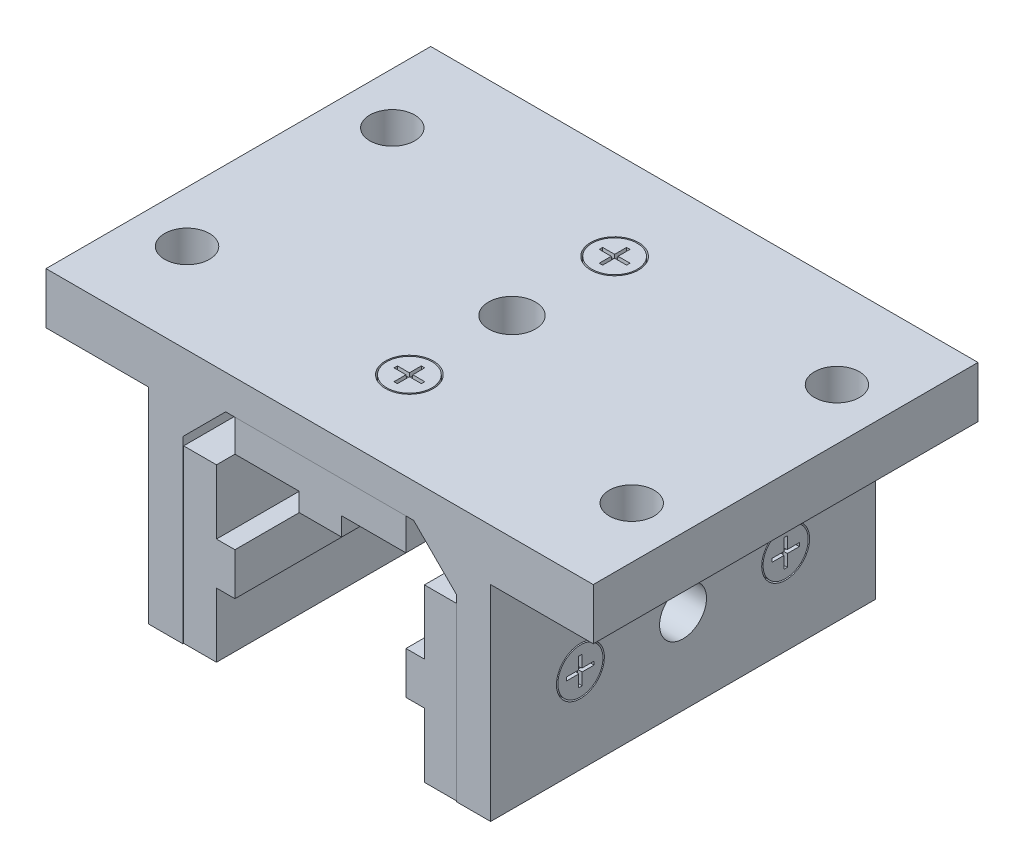
from build123d import *

# Parameters (mm, degrees)
BOSS_EXTRUDE1_DEPTH       = 35.7124
BOSS_EXTRUDE2_DEPTH       = 35.56
BOSS_EXTRUDE2_2_DEPTH     = 35.56
SKETCH11_W                = 7.874
SKETCH11_H                = 7.874
CUT_EXTRUDE5_DEPTH        = 77.234223048
SKETCH12_W                = 7.874
SKETCH12_H                = 7.874
CUT_EXTRUDE6_DEPTH        = 58.371600237
SKETCH3_R                 = 4.445
SKETCH3_R_2               = 4.191
CUT_EXTRUDE1_DEPTH        = 3.175
CUT_EXTRUDE2_DEPTH        = 0.762
CUT_EXTRUDE2_DRAFT        = -5
SKETCH13_R                = 4.445
SKETCH13_R_2              = 4.191
CUT_EXTRUDE_THIN1_DEPTH   = 3.175
CUT_EXTRUDE7_DEPTH        = 0.762
CUT_EXTRUDE7_DRAFT        = -5
MIRROR4_COPY_1_DEPTH      = 0.762
MIRROR4_COPY_1_DRAFT      = -5
MIRROR3_COPY_1_DEPTH      = 0.762
MIRROR3_COPY_1_DRAFT      = -5
MIRROR3_COPY_2_DEPTH      = 0.762
MIRROR3_COPY_2_DRAFT      = -5
MIRROR3_COPY_3_SKETCH_R   = 4.445
MIRROR3_COPY_3_SKETCH_R_2 = 4.191
MIRROR3_COPY_3_DEPTH      = 3.175
MIRROR3_COPY_4_DEPTH      = 0.762
MIRROR3_COPY_4_DRAFT      = -5
SKETCH9_R                 = 4.3561
CUT_EXTRUDE4_DEPTH        = 68.46538845
CUT_EXTRUDE8_DEPTH        = 68.46538845
CUT_EXTRUDE8_DEPTH_BACK   = 68.46538845
SKETCH15_R                = 4.3561
TOP_START                 = -35.7124
SKETCH16_W                = 22.225
SKETCH16_H                = 9.525
TOP_FLANGE_DEPTH          = 71.4248
SKETCH17_R                = 4.1656
TOP_FLANGE_HOLE_DEPTH     = 79.256987795


with BuildPart() as part:
    # Sketch1 → Boss-Extrude1 (new, symmetric)
    with BuildSketch(Plane.XY):
        Polygon((-25.4, 0), (-25.4, 33.3248), (-17.4498, 41.275), (17.4498, 41.275), (25.4, 33.3248), (25.4, 0), (31.75, 0), (31.75, 47.625), (-31.75, 47.625), (-31.75, 0), align=None)
    extrude(amount=BOSS_EXTRUDE1_DEPTH, both=True)

    # Sketch3 → Cut-Extrude1 (cut)
    with BuildSketch(Plane(origin=(0, 47.625, 0), x_dir=(1, 0, 0), z_dir=(0, 1, 0))):
        with Locations(Location((0, -19.05, 0), (0, 0, 270))):
            Circle(SKETCH3_R)
        with Locations(Location((0, -19.05, 0), (0, 0, 270))):
            Circle(SKETCH3_R_2, mode=Mode.SUBTRACT)
    cut_extrude1 = extrude(amount=-CUT_EXTRUDE1_DEPTH, mode=Mode.SUBTRACT)


with BuildPart() as body_2:
    # Sketch2 → Boss-Extrude2 (new, symmetric)
    with BuildSketch(Plane.XY):
        Polygon((-19.304, 19.812), (-19.304, 31.75), (-25.4, 31.75), (-25.4, 0), (-19.304, 0), (-19.304, 11.938), (-15.875, 11.938), (-15.875, 19.812), align=None)
    extrude(amount=BOSS_EXTRUDE2_DEPTH, both=True)

    # Sketch11 → Cut-Extrude5 (cut, through all)
    with BuildSketch(Plane(origin=(-15.875, 0, 0), x_dir=(0, 0, -1), z_dir=(1, 0, 0))):
        with Locations((0, 15.875)):
            Rectangle(SKETCH11_W, SKETCH11_H)
    extrude(amount=-CUT_EXTRUDE5_DEPTH, mode=Mode.SUBTRACT)


with BuildPart() as body_3:
    # Sketch2 → Boss-Extrude2 2 (new, symmetric)
    with BuildSketch(Plane.XY):
        Polygon((-15.875, 41.275), (15.875, 41.275), (15.875, 35.179), (3.937, 35.179), (3.937, 31.75), (-3.937, 31.75), (-3.937, 35.179), (-15.875, 35.179), align=None)
    extrude(amount=BOSS_EXTRUDE2_2_DEPTH, both=True)

    # Sketch12 → Cut-Extrude6 (cut, through all)
    with BuildSketch(Plane.XZ.offset(-31.75)):
        Rectangle(SKETCH12_W, SKETCH12_H)
    extrude(amount=-CUT_EXTRUDE6_DEPTH, mode=Mode.SUBTRACT)


with BuildPart() as body_4:
    # Mirror1: mirrored copy
    add(body_2.part.mirror(Plane(origin=(0, 0, 0), x_dir=(0, 0, 1), z_dir=(1, 0, 0))))


with BuildPart() as cut_extrude2_tool:
    # Sketch5 → Cut-Extrude2 (with draft: the straight prism first)
    with BuildSketch(Plane(origin=(0, 47.625, 0), x_dir=(1, 0, 0), z_dir=(0, 1, 0))):
        Polygon((0.3175, -18.7325), (0.3175, -16.51), (-0.3175, -16.51), (-0.3175, -18.7325), (-2.54, -18.7325), (-2.54, -19.3675), (-0.3175, -19.3675), (-0.3175, -21.59), (0.3175, -21.59), (0.3175, -19.3675), (2.54, -19.3675), (2.54, -18.7325), align=None)
    extrude(amount=-CUT_EXTRUDE2_DEPTH)
    # Cut-Extrude2: the draft: its side faces are tilted about the plane it starts from
    cut_extrude2_sides = [cut_extrude2_tool.faces().sort_by_distance(p)[0] for p in [
        (0.3175, 47.244, 17.62125),
        (0, 47.244, 16.51),
        (-0.3175, 47.244, 17.62125),
        (-1.42875, 47.244, 18.7325),
        (-2.54, 47.244, 19.05),
        (-1.42875, 47.244, 19.3675),
        (-0.3175, 47.244, 20.47875),
        (0, 47.244, 21.59),
        (0.3175, 47.244, 20.47875),
        (1.42875, 47.244, 19.3675),
        (2.54, 47.244, 19.05),
        (1.42875, 47.244, 18.7325),
    ]]
    draft(cut_extrude2_sides, Plane(origin=(0, 47.625, 0), x_dir=(1, 0, 0), z_dir=(0, 1, 0)), CUT_EXTRUDE2_DRAFT)


with BuildPart() as part_1:
    add(part.part)

    # Cut-Extrude2: cut by cut_extrude2_tool
    add(cut_extrude2_tool.part, mode=Mode.SUBTRACT)

    # Sketch13 → Cut-Extrude-Thin1 (cut)
    with BuildSketch(Plane(origin=(31.75, 0, 0), x_dir=(0, 0, -1), z_dir=(1, 0, 0))):
        with Locations((-19.05, 15.875)):
            Circle(SKETCH13_R)
        with Locations((-19.05, 15.875)):
            Circle(SKETCH13_R_2, mode=Mode.SUBTRACT)
    cut_extrude_thin1 = extrude(amount=-CUT_EXTRUDE_THIN1_DEPTH, mode=Mode.SUBTRACT)


with BuildPart() as cut_extrude7_tool:
    # Sketch14 → Cut-Extrude7 (with draft: the straight prism first)
    with BuildSketch(Plane(origin=(31.75, 0, 0), x_dir=(0, 0, -1), z_dir=(1, 0, 0))):
        Polygon((-19.3675, 15.5575), (-19.3675, 13.335), (-18.7325, 13.335), (-18.7325, 15.5575), (-16.51, 15.5575), (-16.51, 16.1925), (-18.7325, 16.1925), (-18.7325, 18.415), (-19.3675, 18.415), (-19.3675, 16.1925), (-21.59, 16.1925), (-21.59, 15.5575), align=None)
    extrude(amount=-CUT_EXTRUDE7_DEPTH)
    # Cut-Extrude7: the draft: its side faces are tilted about the plane it starts from
    cut_extrude7_sides = [cut_extrude7_tool.faces().sort_by_distance(p)[0] for p in [
        (31.369, 14.44625, 19.3675),
        (31.369, 13.335, 19.05),
        (31.369, 14.44625, 18.7325),
        (31.369, 15.5575, 17.62125),
        (31.369, 15.875, 16.51),
        (31.369, 16.1925, 17.62125),
        (31.369, 17.30375, 18.7325),
        (31.369, 18.415, 19.05),
        (31.369, 17.30375, 19.3675),
        (31.369, 16.1925, 20.47875),
        (31.369, 15.875, 21.59),
        (31.369, 15.5575, 20.47875),
    ]]
    draft(cut_extrude7_sides, Plane(origin=(31.75, 0, 0), x_dir=(0, 0, -1), z_dir=(1, 0, 0)), CUT_EXTRUDE7_DRAFT)


with BuildPart() as part_2:
    add(part_1.part)

    # Cut-Extrude7: cut by cut_extrude7_tool
    add(cut_extrude7_tool.part, mode=Mode.SUBTRACT)

    # Mirror4: Cut-Extrude-Thin1 across plane
    add(cut_extrude_thin1.mirror(Plane(origin=(0, 0, 0), x_dir=(0, 0, 1), z_dir=(1, 0, 0))), mode=Mode.SUBTRACT)


with BuildPart() as mirror4_copy_1_tool:
    # Mirror4 copy 1 sketch → Mirror4 copy 1 (with draft: the straight prism first)
    with BuildSketch(Plane(origin=(-31.75, 0, 0), x_dir=(0, 0, -1), z_dir=(-1, 0, 0))):
        Polygon((-19.3675, -15.5575), (-19.3675, -13.335), (-18.7325, -13.335), (-18.7325, -15.5575), (-16.51, -15.5575), (-16.51, -16.1925), (-18.7325, -16.1925), (-18.7325, -18.415), (-19.3675, -18.415), (-19.3675, -16.1925), (-21.59, -16.1925), (-21.59, -15.5575), align=None)
    extrude(amount=-MIRROR4_COPY_1_DEPTH)
    # Mirror4 copy 1: the draft: its side faces are tilted about the plane it starts from
    mirror4_copy_1_sides = [mirror4_copy_1_tool.faces().sort_by_distance(p)[0] for p in [
        (-31.369, 14.44625, 19.3675),
        (-31.369, 13.335, 19.05),
        (-31.369, 14.44625, 18.7325),
        (-31.369, 15.5575, 17.62125),
        (-31.369, 15.875, 16.51),
        (-31.369, 16.1925, 17.62125),
        (-31.369, 17.30375, 18.7325),
        (-31.369, 18.415, 19.05),
        (-31.369, 17.30375, 19.3675),
        (-31.369, 16.1925, 20.47875),
        (-31.369, 15.875, 21.59),
        (-31.369, 15.5575, 20.47875),
    ]]
    draft(mirror4_copy_1_sides, Plane(origin=(-31.75, 0, 0), x_dir=(0, 0, -1), z_dir=(-1, 0, 0)), MIRROR4_COPY_1_DRAFT)


with BuildPart() as part_3:
    add(part_2.part)

    # Mirror4 copy 1: cut by mirror4_copy_1_tool
    add(mirror4_copy_1_tool.part, mode=Mode.SUBTRACT)

    # Mirror3: Cut-Extrude1, Cut-Extrude-Thin1 across plane
    add(cut_extrude1.mirror(Plane.XY), mode=Mode.SUBTRACT)
    add(cut_extrude_thin1.mirror(Plane.XY), mode=Mode.SUBTRACT)


with BuildPart() as mirror3_copy_1_tool:
    # Mirror3 copy 1 sketch → Mirror3 copy 1 (with draft: the straight prism first)
    with BuildSketch(Plane(origin=(0, 47.625, 0), x_dir=(1, 0, 0), z_dir=(0, 1, 0))):
        Polygon((0.3175, 18.7325), (0.3175, 16.51), (-0.3175, 16.51), (-0.3175, 18.7325), (-2.54, 18.7325), (-2.54, 19.3675), (-0.3175, 19.3675), (-0.3175, 21.59), (0.3175, 21.59), (0.3175, 19.3675), (2.54, 19.3675), (2.54, 18.7325), align=None)
    extrude(amount=-MIRROR3_COPY_1_DEPTH)
    # Mirror3 copy 1: the draft: its side faces are tilted about the plane it starts from
    mirror3_copy_1_sides = [mirror3_copy_1_tool.faces().sort_by_distance(p)[0] for p in [
        (0.3175, 47.244, -17.62125),
        (0, 47.244, -16.51),
        (-0.3175, 47.244, -17.62125),
        (-1.42875, 47.244, -18.7325),
        (-2.54, 47.244, -19.05),
        (-1.42875, 47.244, -19.3675),
        (-0.3175, 47.244, -20.47875),
        (0, 47.244, -21.59),
        (0.3175, 47.244, -20.47875),
        (1.42875, 47.244, -19.3675),
        (2.54, 47.244, -19.05),
        (1.42875, 47.244, -18.7325),
    ]]
    draft(mirror3_copy_1_sides, Plane(origin=(0, 47.625, 0), x_dir=(1, 0, 0), z_dir=(0, 1, 0)), MIRROR3_COPY_1_DRAFT)


with BuildPart() as part_4:
    add(part_3.part)

    # Mirror3 copy 1: cut by mirror3_copy_1_tool
    add(mirror3_copy_1_tool.part, mode=Mode.SUBTRACT)


with BuildPart() as mirror3_copy_2_tool:
    # Mirror3 copy 2 sketch → Mirror3 copy 2 (with draft: the straight prism first)
    with BuildSketch(Plane(origin=(31.75, 0, 0), x_dir=(0, 0, 1), z_dir=(1, 0, 0))):
        Polygon((-19.3675, -15.5575), (-19.3675, -13.335), (-18.7325, -13.335), (-18.7325, -15.5575), (-16.51, -15.5575), (-16.51, -16.1925), (-18.7325, -16.1925), (-18.7325, -18.415), (-19.3675, -18.415), (-19.3675, -16.1925), (-21.59, -16.1925), (-21.59, -15.5575), align=None)
    extrude(amount=-MIRROR3_COPY_2_DEPTH)
    # Mirror3 copy 2: the draft: its side faces are tilted about the plane it starts from
    mirror3_copy_2_sides = [mirror3_copy_2_tool.faces().sort_by_distance(p)[0] for p in [
        (31.369, 14.44625, -19.3675),
        (31.369, 13.335, -19.05),
        (31.369, 14.44625, -18.7325),
        (31.369, 15.5575, -17.62125),
        (31.369, 15.875, -16.51),
        (31.369, 16.1925, -17.62125),
        (31.369, 17.30375, -18.7325),
        (31.369, 18.415, -19.05),
        (31.369, 17.30375, -19.3675),
        (31.369, 16.1925, -20.47875),
        (31.369, 15.875, -21.59),
        (31.369, 15.5575, -20.47875),
    ]]
    draft(mirror3_copy_2_sides, Plane(origin=(31.75, 0, 0), x_dir=(0, 0, 1), z_dir=(1, 0, 0)), MIRROR3_COPY_2_DRAFT)


with BuildPart() as part_5:
    add(part_4.part)

    # Mirror3 copy 2: cut by mirror3_copy_2_tool
    add(mirror3_copy_2_tool.part, mode=Mode.SUBTRACT)

    # Mirror3 copy 3 sketch → Mirror3 copy 3 (cut)
    with BuildSketch(Plane.ZY.offset(31.75)):
        with Locations((-19.05, 15.875)):
            Circle(MIRROR3_COPY_3_SKETCH_R)
        with Locations((-19.05, 15.875)):
            Circle(MIRROR3_COPY_3_SKETCH_R_2, mode=Mode.SUBTRACT)
    extrude(amount=-MIRROR3_COPY_3_DEPTH, mode=Mode.SUBTRACT)


with BuildPart() as mirror3_copy_4_tool:
    # Mirror3 copy 4 sketch → Mirror3 copy 4 (with draft: the straight prism first)
    with BuildSketch(Plane.ZY.offset(31.75)):
        Polygon((-19.3675, 15.5575), (-19.3675, 13.335), (-18.7325, 13.335), (-18.7325, 15.5575), (-16.51, 15.5575), (-16.51, 16.1925), (-18.7325, 16.1925), (-18.7325, 18.415), (-19.3675, 18.415), (-19.3675, 16.1925), (-21.59, 16.1925), (-21.59, 15.5575), align=None)
    extrude(amount=-MIRROR3_COPY_4_DEPTH)
    # Mirror3 copy 4: the draft: its side faces are tilted about the plane it starts from
    mirror3_copy_4_sides = [mirror3_copy_4_tool.faces().sort_by_distance(p)[0] for p in [
        (-31.369, 14.44625, -19.3675),
        (-31.369, 13.335, -19.05),
        (-31.369, 14.44625, -18.7325),
        (-31.369, 15.5575, -17.62125),
        (-31.369, 15.875, -16.51),
        (-31.369, 16.1925, -17.62125),
        (-31.369, 17.30375, -18.7325),
        (-31.369, 18.415, -19.05),
        (-31.369, 17.30375, -19.3675),
        (-31.369, 16.1925, -20.47875),
        (-31.369, 15.875, -21.59),
        (-31.369, 15.5575, -20.47875),
    ]]
    draft(mirror3_copy_4_sides, Plane.ZY.offset(31.75), MIRROR3_COPY_4_DRAFT)


with BuildPart() as part_6:
    add(part_5.part)

    # Mirror3 copy 4: cut by mirror3_copy_4_tool
    add(mirror3_copy_4_tool.part, mode=Mode.SUBTRACT)

    # Sketch9 → Cut-Extrude4 (cut, through all)
    with BuildSketch(Plane(origin=(0, 47.625, 0), x_dir=(1, 0, 0), z_dir=(0, 1, 0))):
        with Locations(Location((0, 0, 0), (0, 0, 270))):
            Circle(SKETCH9_R)
    extrude(amount=-CUT_EXTRUDE4_DEPTH, mode=Mode.SUBTRACT)

    # Sketch15 → Cut-Extrude8 (cut, two sides: drawn at the far end of the back side and taken through both)
    with BuildSketch(Plane(origin=(0, 0, 0), x_dir=(0, 0, -1), z_dir=(1, 0, 0)).offset(-CUT_EXTRUDE8_DEPTH_BACK)):
        with Locations((0, 15.875)):
            Circle(SKETCH15_R)
    extrude(amount=CUT_EXTRUDE8_DEPTH + CUT_EXTRUDE8_DEPTH_BACK, mode=Mode.SUBTRACT)

    # Sketch16 → Top Flange (add)
    with BuildSketch(Plane.XY.offset(TOP_START)):
        with Locations((-39.6875, 42.8625)):
            Rectangle(SKETCH16_W, SKETCH16_H)
        with Locations((39.6875, 42.8625)):
            Rectangle(SKETCH16_W, SKETCH16_H)
    extrude(amount=TOP_FLANGE_DEPTH)

    # Sketch17 → Top Flange Hole (cut, through all)
    with BuildSketch(Plane(origin=(0, 47.625, 0), x_dir=(1, 0, 0), z_dir=(0, 1, 0))):
        with Locations(Location((41.275, 19.05, 0), (0, 0, 270))):
            Circle(SKETCH17_R)
        with Locations(Location((41.275, -19.05, 0), (0, 0, 270))):
            Circle(SKETCH17_R)
        with Locations(Location((-41.275, 19.05, 0), (0, 0, 270))):
            Circle(SKETCH17_R)
        with Locations(Location((-41.275, -19.05, 0), (0, 0, 270))):
            Circle(SKETCH17_R)
    extrude(amount=-TOP_FLANGE_HOLE_DEPTH, mode=Mode.SUBTRACT)


solid = Compound([body_2.part, body_3.part, body_4.part, part_6.part])
